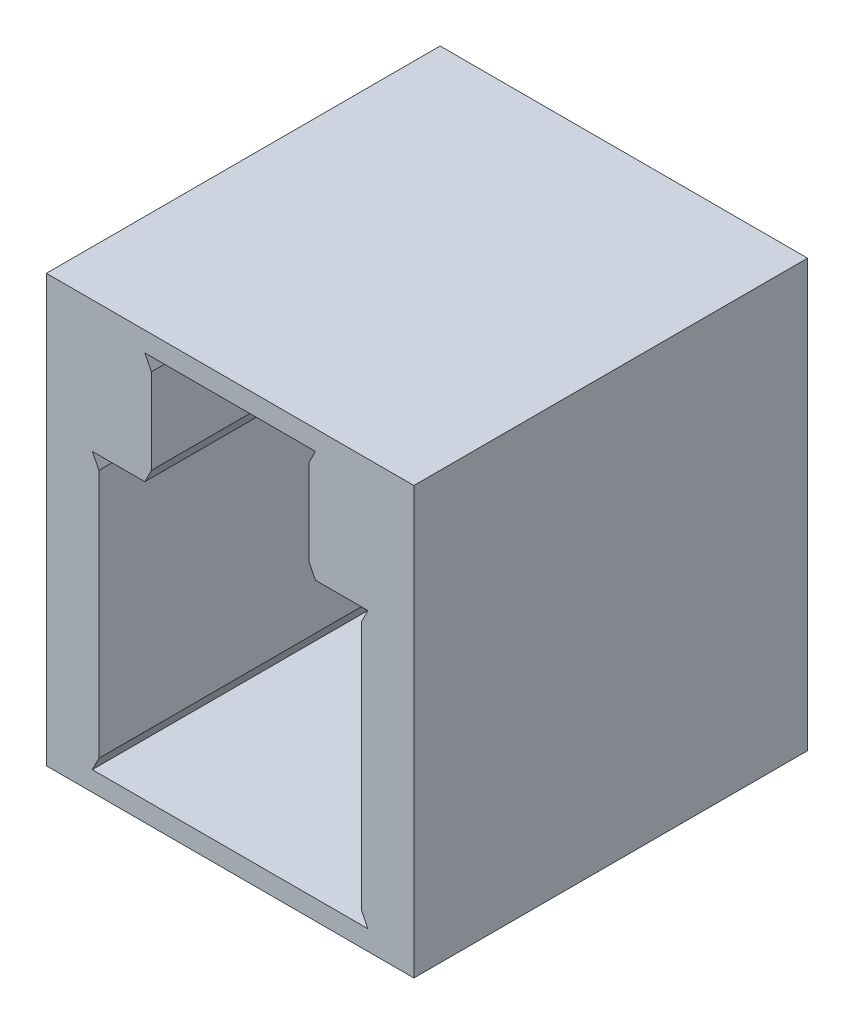
from build123d import *

# Parameters (mm, degrees)
SKETCH1_W               = 28
SKETCH1_H               = 30
BOSS_EXTRUDE1_DEPTH     = 32.5
CUT_EXTRUDE1_DEPTH      = 53.347397261
CUT_EXTRUDE1_DEPTH_BACK = 53.347397261
SKETCH2_W               = 20
SKETCH2_H               = 21
CUT_EXTRUDE2_DEPTH      = 53.347397261
CUT_EXTRUDE2_DEPTH_BACK = 53.347397261
SKETCH3_W               = 12
SKETCH3_H               = 8.5
CUT_EXTRUDE3_DEPTH      = 53.347397261
CUT_EXTRUDE3_DEPTH_BACK = 53.347397261


with BuildPart() as part:
    # Sketch1 → Boss-Extrude1 (new body)
    with BuildSketch(Plane(origin=(0, 0, 0), x_dir=(1, 0, 0), z_dir=(0, 1, 0))):
        with Locations((14, 15)):
            Rectangle(SKETCH1_W, SKETCH1_H)
    extrude(amount=BOSS_EXTRUDE1_DEPTH)

    # Sketch2 → Cut-Extrude1 (cut, two sides: drawn at the far end of the back side and taken through both)
    with BuildSketch(Plane.XY.offset(-CUT_EXTRUDE1_DEPTH_BACK)):
        with Locations((14, 12)):
            Rectangle(SKETCH2_W, SKETCH2_H)
    extrude(amount=CUT_EXTRUDE1_DEPTH + CUT_EXTRUDE1_DEPTH_BACK, mode=Mode.SUBTRACT)

    # Sketch3 → Cut-Extrude2 (cut, two sides: drawn at the far end of the back side and taken through both)
    with BuildSketch(Plane.XY.offset(-CUT_EXTRUDE2_DEPTH_BACK)):
        with Locations((14, 26.75)):
            Rectangle(SKETCH3_W, SKETCH3_H)
    extrude(amount=CUT_EXTRUDE2_DEPTH + CUT_EXTRUDE2_DEPTH_BACK, mode=Mode.SUBTRACT)

    # Sketch4 → Cut-Extrude3 (cut, two sides: drawn at the far end of the back side and taken through both)
    with BuildSketch(Plane.XY.offset(-CUT_EXTRUDE3_DEPTH_BACK)):
        Polygon((8, 22.5), (8, 23.5), (7.5, 22.5), align=None)
        Polygon((4, 22.5), (3.5, 22.5), (4, 21.5), align=None)
        Polygon((20, 22.5), (20, 23.5), (20.5, 22.5), align=None)
        Polygon((8, 31), (7.5, 31), (8, 30), align=None)
        Polygon((20, 31), (20.5, 31), (20, 30), align=None)
        Polygon((24, 22.5), (24.5, 22.5), (24, 21.5), align=None)
        Polygon((24, 1.5), (24.5, 1.5), (24, 2.5), align=None)
        Polygon((4, 1.5), (3.5, 1.5), (4, 2.5), align=None)
    extrude(amount=CUT_EXTRUDE3_DEPTH + CUT_EXTRUDE3_DEPTH_BACK, mode=Mode.SUBTRACT)


solid = part.part
